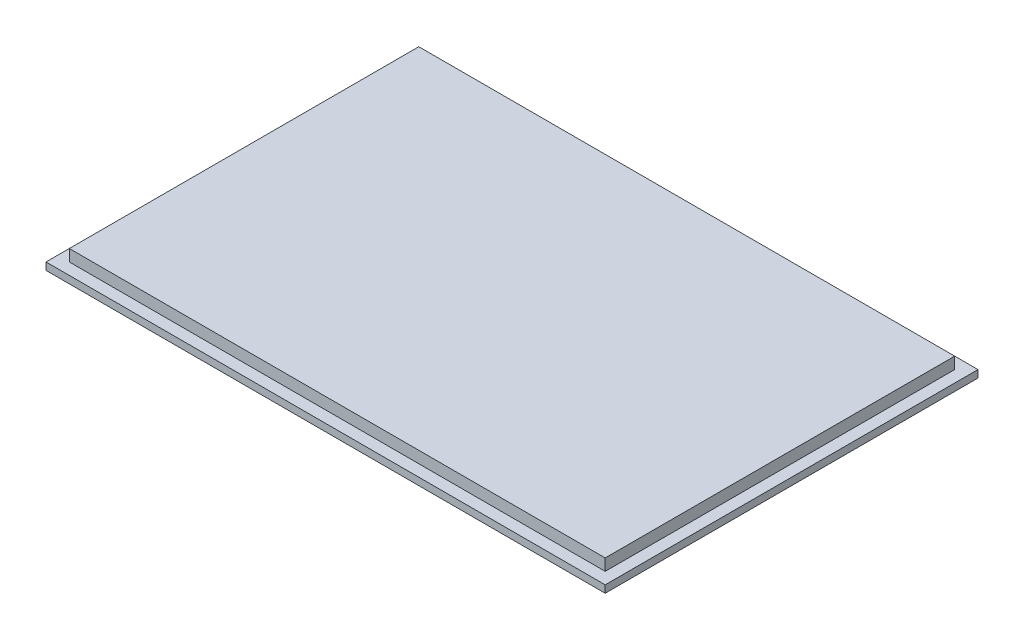
from build123d import *

# Parameters (mm, degrees)
SKETCH1_W           = 152.4
SKETCH1_H           = 101.6
BOSS_EXTRUDE1_DEPTH = 2
SKETCH1_3_W         = 146.05
SKETCH1_3_H         = 95.25
BOSS_EXTRUDE2_DEPTH = 5.175


with BuildPart() as part:
    # Sketch1 → Boss-Extrude1 (new body)
    with BuildSketch(Plane(origin=(0, 0, 0), x_dir=(1, 0, 0), z_dir=(0, 1, 0))):
        with Locations((-13.536732852, 1.467148014)):
            Rectangle(SKETCH1_W, SKETCH1_H)
    extrude(amount=BOSS_EXTRUDE1_DEPTH)

    # Sketch1<3> → Boss-Extrude2 (add)
    with BuildSketch(Plane(origin=(0, 0, 0), x_dir=(1, 0, 0), z_dir=(0, 1, 0))):
        with Locations((-13.536732852, 1.467148014)):
            Rectangle(SKETCH1_3_W, SKETCH1_3_H)
    extrude(amount=BOSS_EXTRUDE2_DEPTH)


solid = part.part
